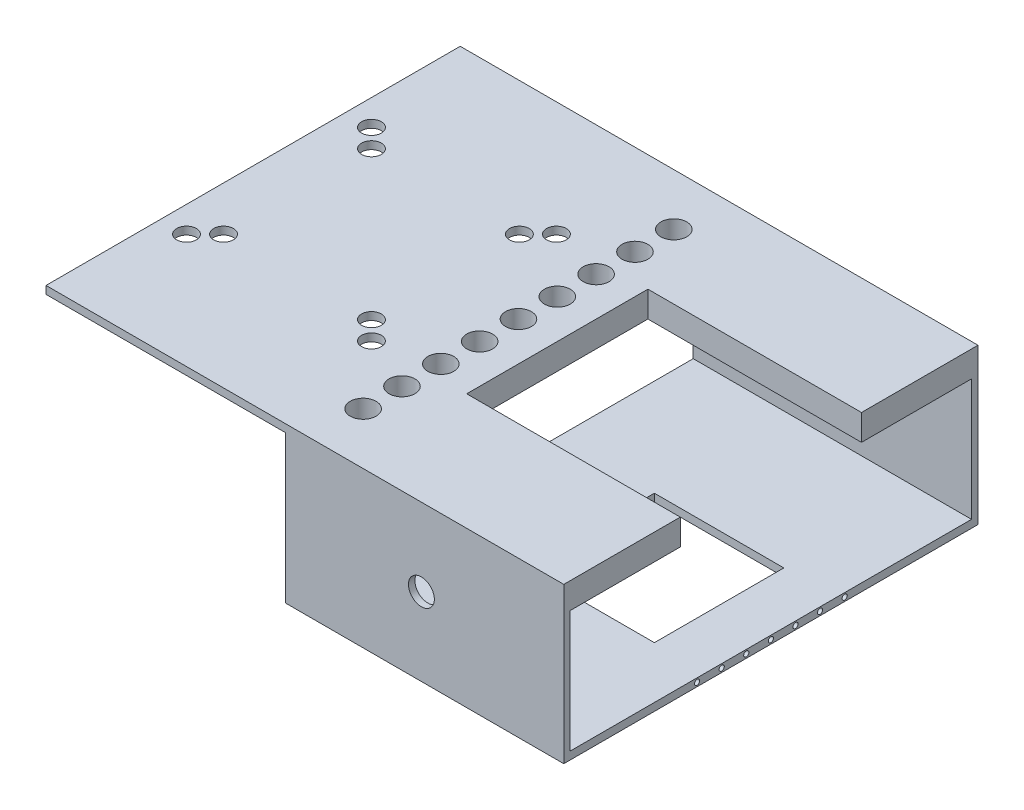
from build123d import *

# Parameters (mm, degrees)
SKETCH_1_W                = 400
SKETCH_1_H                = 320
EXTRUDE_7_DEPTH           = 120
SKETCH_6_R                = 7.620000001
SKETCH_6_R_2              = 7.62
CUT_EXTRUDE_3_DEPTH       = 283.842712475
CUT_EXTRUDE_START         = -120
SKETCH_7_W                = 185
SKETCH_7_H                = 320
CUT_EXTRUDE_4_DEPTH       = 114
SKETCH_8_W                = 310
SKETCH_8_H                = 94
CUT_EXTRUDE_5_DEPTH       = 448.2135955
SKETCH_10_R               = 10
CUT_EXTRUDE_7_DEPTH       = 396.979797464
CUT_EXTRUDE_8_REACH       = 284.843
SKETCH_12_R               = 10
SKETCH_13_R               = 2
CUT_EXTRUDE_9_DEPTH       = 20
CUT_EXTRUDE_12_DEPTH      = 281.349781523
CUT_EXTRUDE_12_DEPTH_BACK = 281.349781523
SKETCH_14_W               = 100
SKETCH_14_H               = 100
CUT_EXTRUDE_13_REACH      = 284.843
SKETCH_15_W               = 165
SKETCH_15_H               = 140


with BuildPart() as part:
    # 草图1 → 凸台-拉伸7 (new body)
    with BuildSketch(Plane(origin=(0, 0, 0), x_dir=(1, 0, 0), z_dir=(0, 1, 0))):
        Rectangle(SKETCH_1_W, SKETCH_1_H)
    extrude(amount=EXTRUDE_7_DEPTH)

    # 草图6 → 切除-拉伸3 (cut, through all)
    with BuildSketch(Plane(origin=(0, 120, 0), x_dir=(1, 0, 0), z_dir=(0, 1, 0))):
        with Locations(Location((-180, -71.4375, 0), (0, 0, 270))):
            Circle(SKETCH_6_R)
        with Locations(Location((-165.712492884, 57.173286175, 0), (0, 0, 270))):
            Circle(SKETCH_6_R_2)
        with Locations(Location((-165.7125, -57.126713825, 0), (0, 0, 270))):
            Circle(SKETCH_6_R_2)
        with Locations(Location((-180, 71.4375, 0), (0, 0, 270))):
            Circle(SKETCH_6_R_2)
        with Locations(Location((-37.125, 71.4375, 0), (0, 0, 270))):
            Circle(SKETCH_6_R_2)
        with Locations(Location((-51.412502372, 57.126713825, 0), (0, 0, 270))):
            Circle(SKETCH_6_R_2)
        with Locations(Location((-51.412509488, -57.173286175, 0), (0, 0, 270))):
            Circle(SKETCH_6_R_2)
        with Locations(Location((-37.125, -71.4375, 0), (0, 0, 270))):
            Circle(SKETCH_6_R_2)
    extrude(amount=-CUT_EXTRUDE_3_DEPTH, mode=Mode.SUBTRACT)

    # 草图7 → 切除-拉伸4 (cut)
    with BuildSketch(Plane(origin=(0, 120, 0), x_dir=(1, 0, 0), z_dir=(0, 1, 0)).offset(CUT_EXTRUDE_START)):
        with Locations((-107.5, 0)):
            Rectangle(SKETCH_7_W, SKETCH_7_H)
    extrude(amount=CUT_EXTRUDE_4_DEPTH, mode=Mode.SUBTRACT)

    # 草图8 → 切除-拉伸5 (cut, through all)
    with BuildSketch(Plane(origin=(200, 0, 0), x_dir=(0, 0, -1), z_dir=(1, 0, 0))):
        with Locations((0, 53)):
            Rectangle(SKETCH_8_W, SKETCH_8_H)
    extrude(amount=-CUT_EXTRUDE_5_DEPTH, mode=Mode.SUBTRACT)

    # 草图10 → 切除-拉伸7 (cut, through all)
    with BuildSketch(Plane.XY.offset(160)):
        with Locations((90, 60)):
            Circle(SKETCH_10_R)
    extrude(amount=-CUT_EXTRUDE_7_DEPTH, mode=Mode.SUBTRACT)

    # 草图12 → 切除-拉伸8 (cut, up to next)
    with BuildSketch(Plane(origin=(0, 120, 0), x_dir=(1, 0, 0), z_dir=(0, 1, 0)), mode=Mode.PRIVATE) as cut_extrude_8_sk1:
        with Locations(Location((5, 90, 0), (0, 0, 270))):
            Circle(SKETCH_12_R)
    cut_extrude_8_tool1 = extrude(cut_extrude_8_sk1.sketch, amount=-CUT_EXTRUDE_8_REACH, mode=Mode.PRIVATE) & part.part
    # 草图12 → 切除-拉伸8 (cut, up to next)
    with BuildSketch(Plane(origin=(0, 120, 0), x_dir=(1, 0, 0), z_dir=(0, 1, 0)), mode=Mode.PRIVATE) as cut_extrude_8_sk2:
        with Locations(Location((5, 0, 0), (0, 0, 270))):
            Circle(SKETCH_12_R)
    cut_extrude_8_tool2 = extrude(cut_extrude_8_sk2.sketch, amount=-CUT_EXTRUDE_8_REACH, mode=Mode.PRIVATE) & part.part
    # 草图12 → 切除-拉伸8 (cut, up to next)
    with BuildSketch(Plane(origin=(0, 120, 0), x_dir=(1, 0, 0), z_dir=(0, 1, 0)), mode=Mode.PRIVATE) as cut_extrude_8_sk3:
        with Locations(Location((5, 30, 0), (0, 0, 270))):
            Circle(SKETCH_12_R)
    cut_extrude_8_tool3 = extrude(cut_extrude_8_sk3.sketch, amount=-CUT_EXTRUDE_8_REACH, mode=Mode.PRIVATE) & part.part
    # 草图12 → 切除-拉伸8 (cut, up to next)
    with BuildSketch(Plane(origin=(0, 120, 0), x_dir=(1, 0, 0), z_dir=(0, 1, 0)), mode=Mode.PRIVATE) as cut_extrude_8_sk4:
        with Locations(Location((5, 60, 0), (0, 0, 270))):
            Circle(SKETCH_12_R)
    cut_extrude_8_tool4 = extrude(cut_extrude_8_sk4.sketch, amount=-CUT_EXTRUDE_8_REACH, mode=Mode.PRIVATE) & part.part
    # 草图12 → 切除-拉伸8 (cut, up to next)
    with BuildSketch(Plane(origin=(0, 120, 0), x_dir=(1, 0, 0), z_dir=(0, 1, 0)), mode=Mode.PRIVATE) as cut_extrude_8_sk5:
        with Locations(Location((5, -30, 0), (0, 0, 270))):
            Circle(SKETCH_12_R)
    cut_extrude_8_tool5 = extrude(cut_extrude_8_sk5.sketch, amount=-CUT_EXTRUDE_8_REACH, mode=Mode.PRIVATE) & part.part
    # 草图12 → 切除-拉伸8 (cut, up to next)
    with BuildSketch(Plane(origin=(0, 120, 0), x_dir=(1, 0, 0), z_dir=(0, 1, 0)), mode=Mode.PRIVATE) as cut_extrude_8_sk6:
        with Locations(Location((5, -60, 0), (0, 0, 270))):
            Circle(SKETCH_12_R)
    cut_extrude_8_tool6 = extrude(cut_extrude_8_sk6.sketch, amount=-CUT_EXTRUDE_8_REACH, mode=Mode.PRIVATE) & part.part
    # 草图12 → 切除-拉伸8 (cut, up to next)
    with BuildSketch(Plane(origin=(0, 120, 0), x_dir=(1, 0, 0), z_dir=(0, 1, 0)), mode=Mode.PRIVATE) as cut_extrude_8_sk7:
        with Locations(Location((5, -90, 0), (0, 0, 270))):
            Circle(SKETCH_12_R)
    cut_extrude_8_tool7 = extrude(cut_extrude_8_sk7.sketch, amount=-CUT_EXTRUDE_8_REACH, mode=Mode.PRIVATE) & part.part
    # 草图12 → 切除-拉伸8 (cut, up to next)
    with BuildSketch(Plane(origin=(0, 120, 0), x_dir=(1, 0, 0), z_dir=(0, 1, 0)), mode=Mode.PRIVATE) as cut_extrude_8_sk8:
        with Locations(Location((5, 120, 0), (0, 0, 270))):
            Circle(SKETCH_12_R)
    cut_extrude_8_tool8 = extrude(cut_extrude_8_sk8.sketch, amount=-CUT_EXTRUDE_8_REACH, mode=Mode.PRIVATE) & part.part
    # 草图12 → 切除-拉伸8 (cut, up to next)
    with BuildSketch(Plane(origin=(0, 120, 0), x_dir=(1, 0, 0), z_dir=(0, 1, 0)), mode=Mode.PRIVATE) as cut_extrude_8_sk9:
        with Locations(Location((5, -120, 0), (0, 0, 270))):
            Circle(SKETCH_12_R)
    cut_extrude_8_tool9 = extrude(cut_extrude_8_sk9.sketch, amount=-CUT_EXTRUDE_8_REACH, mode=Mode.PRIVATE) & part.part
    add(cut_extrude_8_tool1.solids().sort_by_distance((5, 120, -90))[0], mode=Mode.SUBTRACT)
    add(cut_extrude_8_tool2.solids().sort_by_distance((5, 120, 0))[0], mode=Mode.SUBTRACT)
    add(cut_extrude_8_tool3.solids().sort_by_distance((5, 120, -30))[0], mode=Mode.SUBTRACT)
    add(cut_extrude_8_tool4.solids().sort_by_distance((5, 120, -60))[0], mode=Mode.SUBTRACT)
    add(cut_extrude_8_tool5.solids().sort_by_distance((5, 120, 30))[0], mode=Mode.SUBTRACT)
    add(cut_extrude_8_tool6.solids().sort_by_distance((5, 120, 60))[0], mode=Mode.SUBTRACT)
    add(cut_extrude_8_tool7.solids().sort_by_distance((5, 120, 90))[0], mode=Mode.SUBTRACT)
    add(cut_extrude_8_tool8.solids().sort_by_distance((5, 120, -120))[0], mode=Mode.SUBTRACT)
    add(cut_extrude_8_tool9.solids().sort_by_distance((5, 120, 120))[0], mode=Mode.SUBTRACT)

    # 草图13 → 切除-拉伸9 (cut)
    with BuildSketch(Plane(origin=(200, 0, 0), x_dir=(0, 0, -1), z_dir=(1, 0, 0))):
        with Locations((0, 3)):
            Circle(SKETCH_13_R)
        with Locations((19, 3)):
            Circle(SKETCH_13_R)
        with Locations((38, 3)):
            Circle(SKETCH_13_R)
        with Locations((57, 3)):
            Circle(SKETCH_13_R)
        with Locations((-57, 3)):
            Circle(SKETCH_13_R)
        with Locations((-38, 3)):
            Circle(SKETCH_13_R)
        with Locations((-19, 3)):
            Circle(SKETCH_13_R)
    extrude(amount=-CUT_EXTRUDE_9_DEPTH, mode=Mode.SUBTRACT)

    # 草图14 → 切除-拉伸12 (cut, two sides: drawn at the far end of the back side and taken through both)
    with BuildSketch(Plane(origin=(0, 6, 0), x_dir=(1, 0, 0), z_dir=(0, 1, 0)).offset(-CUT_EXTRUDE_12_DEPTH_BACK)):
        with Locations((110, 0)):
            Rectangle(SKETCH_14_W, SKETCH_14_H)
    extrude(amount=CUT_EXTRUDE_12_DEPTH + CUT_EXTRUDE_12_DEPTH_BACK, mode=Mode.SUBTRACT)

    # 草图15 → 切除-拉伸13 (cut, up to next)
    with BuildSketch(Plane(origin=(0, 120, 0), x_dir=(1, 0, 0), z_dir=(0, 1, 0)), mode=Mode.PRIVATE) as cut_extrude_13_sk1:
        with Locations((117.5, 0)):
            Rectangle(SKETCH_15_W, SKETCH_15_H)
    cut_extrude_13_tool1 = extrude(cut_extrude_13_sk1.sketch, amount=-CUT_EXTRUDE_13_REACH, mode=Mode.PRIVATE) & part.part
    add(cut_extrude_13_tool1.solids().sort_by_distance((117.5, 120, 0))[0], mode=Mode.SUBTRACT)


solid = part.part
